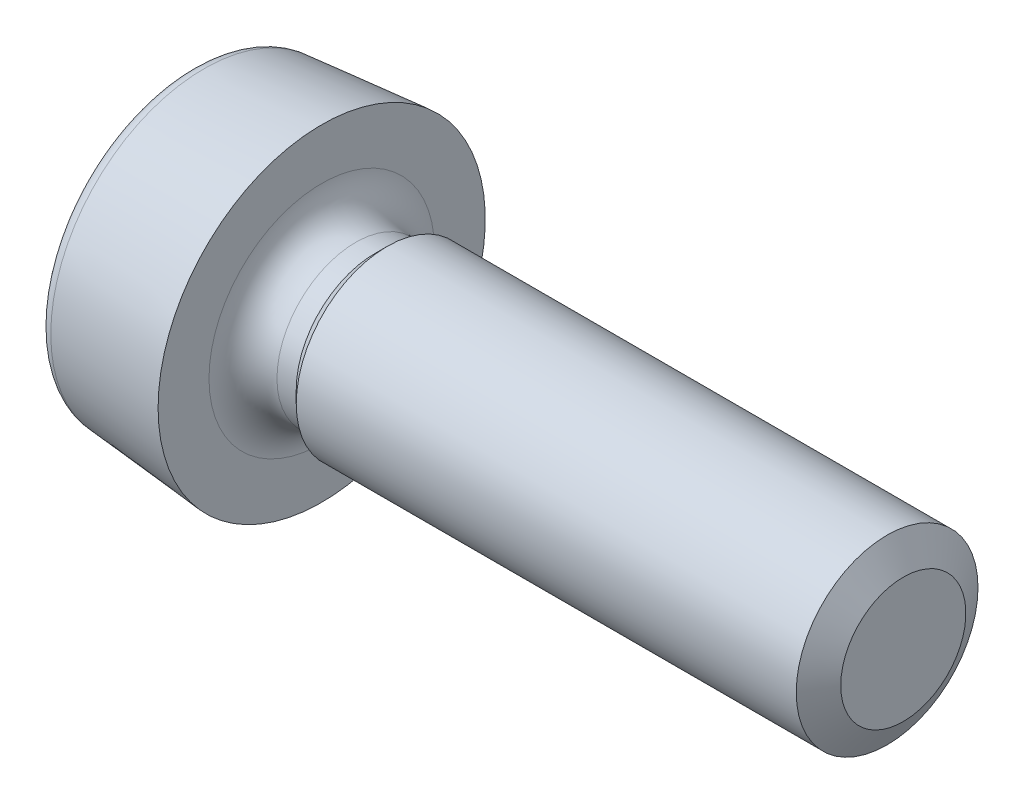
from build123d import *

# Parameters (mm, degrees)
PATTERN_CIRCULAR_1_COUNT = 2
PATTERN_CIRCULAR_1_ANGLE = 90


with BuildPart() as part:
    # 草图3 → Revolve 850 (revolve)
    with BuildSketch(Plane.XY, mode=Mode.PRIVATE) as revolve_850_sk:
        with BuildLine():
            Line((0, 0), (9.8, 0))
            Line((9.8, 0), (9.8, 1.25))
            Line((9.8, 1.25), (2.7, 1.25))
            Line((2.7, 1.25), (2.5325, 1.0825))
            Line((2.5325, 1.0825), (2.2675, 1.0825))
            ThreePointArc((2.2675, 1.0825), (1.93692758, 1.21942758), (1.8, 1.55))
            Line((1.8, 1.55), (1.8, 2.25))
            Line((1.8, 2.25), (0.182568851, 2.10849311))
            ThreePointArc((0.182568851, 2.10849311), (0.052544533, 2.044372212), (0, 1.909254171))
            Line((0, 1.909254171), (0, 0))
        make_face()
    revolve(revolve_850_sk.sketch.rotate(Axis((-2.16958059, 0, 0), (1, 0, 0)), 90), axis=Axis((-2.16958059, 0, 0), (1, 0, 0)))

    # 草图4 → 切除-旋转1 (revolve, cut)
    with BuildSketch(Plane.XY, mode=Mode.PRIVATE) as cut_revolve_1_sk:
        Polygon((9.577437203, 1.25), (10.027437203, 1.25), (9.8, 0.8603), align=None)
    revolve(cut_revolve_1_sk.sketch.rotate(Axis((-0.21798541, 0, 0), (1, 0, 0)), 90), axis=Axis((-0.21798541, 0, 0), (1, 0, 0)), mode=Mode.SUBTRACT)

    # 草图5 → 切除-放样1 section 0
    with BuildSketch(Plane.ZY, mode=Mode.PRIVATE) as loft_1_s0:
        with BuildLine():
            Line((-0.225, 1.35), (0.225, 1.35))
            Line((0.225, 1.35), (0.225, -1.35))
            Line((0.225, -1.35), (-0.225, -1.35))
            Line((-0.225, -1.35), (-0.225, 1.35))
        make_face()
    loft_1 = loft([loft_1_s0.sketch, Vertex(1.2, 0, 0)], mode=Mode.SUBTRACT)

    # 阵列(圆周)1: 切除-放样1 ×2 about axis
    pattern_circular_1_axis = Axis((0, 0, 0), (1, 0, 0))
    for i in range(1, PATTERN_CIRCULAR_1_COUNT):
        add(loft_1.rotate(pattern_circular_1_axis, i * PATTERN_CIRCULAR_1_ANGLE / (PATTERN_CIRCULAR_1_COUNT - 1)), mode=Mode.SUBTRACT)


solid = part.part
